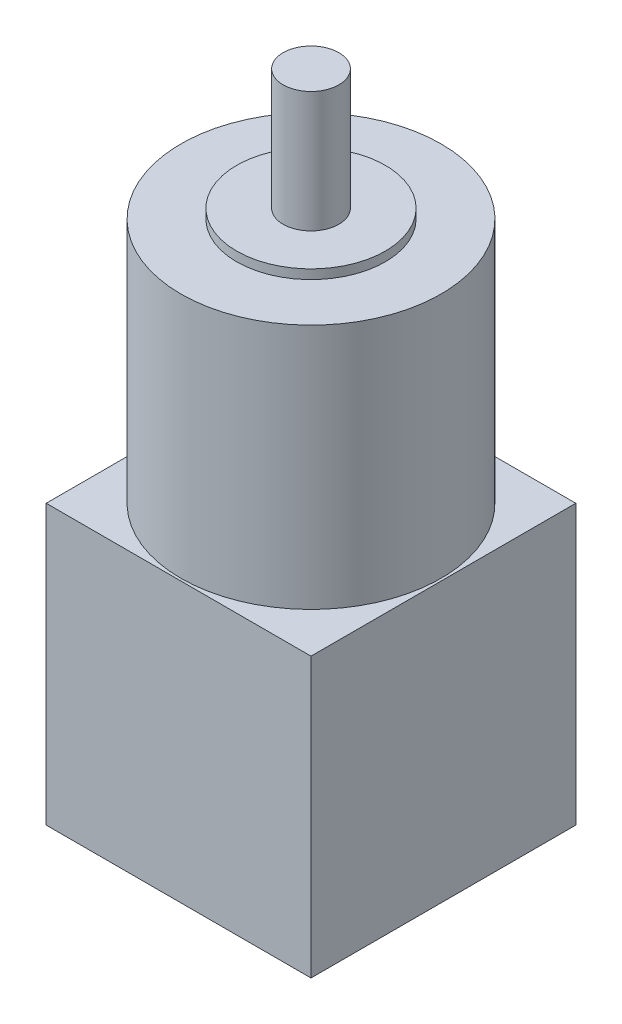
from build123d import *

# Parameters (mm, degrees)
SKETCH1_R           = 28
BOSS_EXTRUDE1_DEPTH = 53
SKETCH2_R           = 16
BOSS_EXTRUDE2_DEPTH = 2
SKETCH3_R           = 6
BOSS_EXTRUDE3_DEPTH = 26
SKETCH4_W           = 57
SKETCH4_H           = 57
BOSS_EXTRUDE4_DEPTH = 60


with BuildPart() as part:
    # Sketch1 → Boss-Extrude1 (new body)
    with BuildSketch(Plane(origin=(0, 0, 0), x_dir=(1, 0, 0), z_dir=(0, 1, 0))):
        with Locations(Location((0, 0, 0), (0, 0, 270))):
            Circle(SKETCH1_R)
    extrude(amount=BOSS_EXTRUDE1_DEPTH)

    # Sketch2 → Boss-Extrude2 (add)
    with BuildSketch(Plane(origin=(0, 53, 0), x_dir=(1, 0, 0), z_dir=(0, 1, 0))):
        with Locations(Location((0, 0, 0), (0, 0, 270))):
            Circle(SKETCH2_R)
    extrude(amount=BOSS_EXTRUDE2_DEPTH)

    # Sketch3 → Boss-Extrude3 (add)
    with BuildSketch(Plane(origin=(0, 55, 0), x_dir=(1, 0, 0), z_dir=(0, 1, 0))):
        with Locations(Location((0, 0, 0), (0, 0, 90))):
            Circle(SKETCH3_R)
    extrude(amount=BOSS_EXTRUDE3_DEPTH)

    # Sketch4 → Boss-Extrude4 (add)
    with BuildSketch(Plane.XZ):
        Rectangle(SKETCH4_W, SKETCH4_H)
    extrude(amount=BOSS_EXTRUDE4_DEPTH)


solid = part.part
